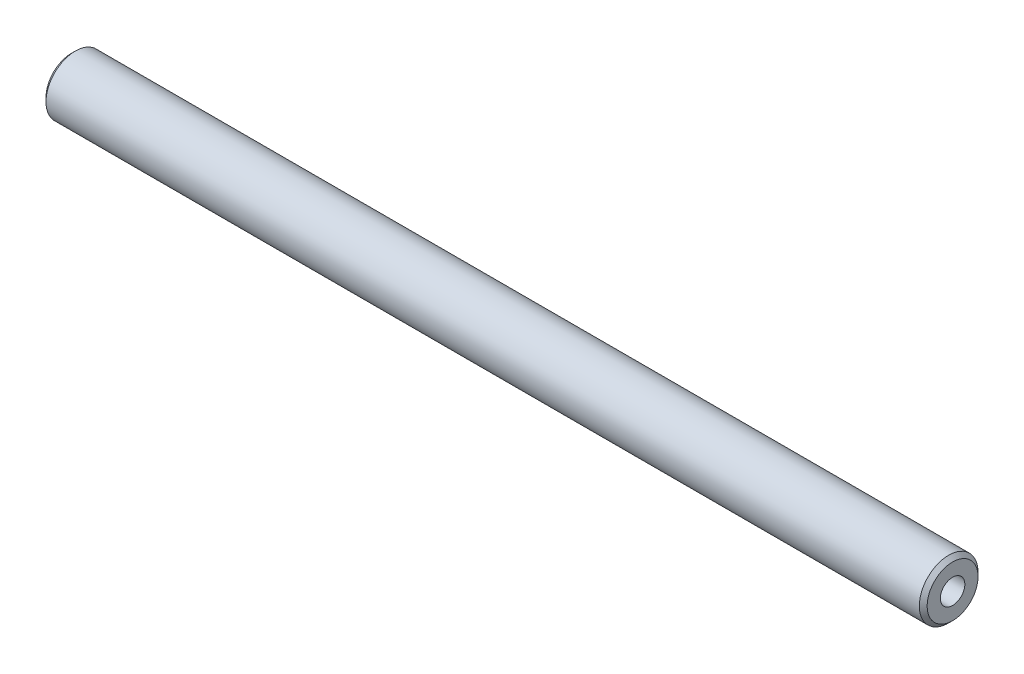
from build123d import *

# Parameters (mm, degrees)
SKETCH1_W           = 90
SKETCH1_H           = 3
CHAMFER1_SIZE       = 0.4
TAPPED_HOLE10_D     = 2.5
TAPPED_HOLE10_DEPTH = 8.5
TAPPED_HOLE10_TIP   = 0.751075774
TAPPED_HOLE11_D     = 2.5
TAPPED_HOLE11_DEPTH = 8.5
TAPPED_HOLE11_TIP   = 0.751075774


with BuildPart() as part:
    # Sketch1 → Revolve1 (revolve)
    with BuildSketch(Plane.XY, mode=Mode.PRIVATE) as revolve1_sk:
        with Locations((45, 1.5)):
            Rectangle(SKETCH1_W, SKETCH1_H)
    revolve(revolve1_sk.sketch.rotate(Axis((0, 0, 0), (1, 0, 0)), 90), axis=Axis((0, 0, 0), (1, 0, 0)))

    # Chamfer1
    chamfer1_edges = [part.edges().sort_by_distance(p)[0] for p in [
        (0, 0, -3),
        (90, 0, -3),
    ]]
    chamfer(chamfer1_edges, length=CHAMFER1_SIZE)

    # Tapped Hole10
    with Locations(Plane.ZY):
        with Locations((0, 0)):
            Hole(TAPPED_HOLE10_D / 2, depth=TAPPED_HOLE10_DEPTH)
            with Locations((0, 0, -(TAPPED_HOLE10_DEPTH + TAPPED_HOLE10_TIP / 2))):  # 118° drill point
                Cone(0, TAPPED_HOLE10_D / 2, TAPPED_HOLE10_TIP, mode=Mode.SUBTRACT)

    # Tapped Hole11
    with Locations(Plane(origin=(90, 0, 0), x_dir=(0, 0, -1), z_dir=(1, 0, 0))):
        with Locations((0, 0)):
            Hole(TAPPED_HOLE11_D / 2, depth=TAPPED_HOLE11_DEPTH)
            with Locations((0, 0, -(TAPPED_HOLE11_DEPTH + TAPPED_HOLE11_TIP / 2))):  # 118° drill point
                Cone(0, TAPPED_HOLE11_D / 2, TAPPED_HOLE11_TIP, mode=Mode.SUBTRACT)


solid = part.part
